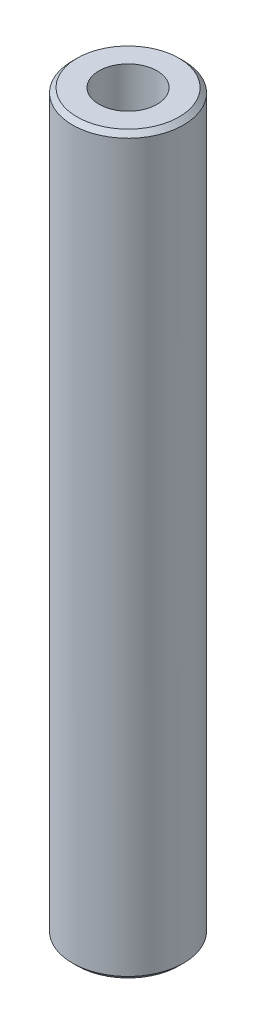
from build123d import *

# Parameters (mm, degrees)
CROQUIS2_R                = 4.7625
SALIENTE_EXTRUIR1_DEPTH   = 31.496
CHAFL_N1_SIZE             = 0.396875
CLEARANCE_HOLE_DEPTH      = 33.208086384
CLEARANCE_HOLE_DEPTH_BACK = 33.208086384
CROQUIS4_R                = 2.4892


with BuildPart() as part:
    # Croquis2 → Saliente-Extruir1 (new, symmetric)
    with BuildSketch(Plane(origin=(0, 0, 0), x_dir=(1, 0, 0), z_dir=(0, 1, 0))):
        Circle(CROQUIS2_R)
    extrude(amount=SALIENTE_EXTRUIR1_DEPTH, both=True)

    # Chaflán1
    chafl_n1_edges = [part.edges().sort_by_distance(p)[0] for p in [
        (-4.7625, -31.496, 0),
        (-4.7625, 31.496, 0),
    ]]
    chamfer(chafl_n1_edges, length=CHAFL_N1_SIZE)

    # Croquis4 → Clearance Hole (cut, two sides: drawn at the far end of the back side and taken through both)
    with BuildSketch(Plane(origin=(0, 0, 0), x_dir=(1, 0, 0), z_dir=(0, 1, 0)).offset(-CLEARANCE_HOLE_DEPTH_BACK)):
        Circle(CROQUIS4_R)
    extrude(amount=CLEARANCE_HOLE_DEPTH + CLEARANCE_HOLE_DEPTH_BACK, mode=Mode.SUBTRACT)


solid = part.part
